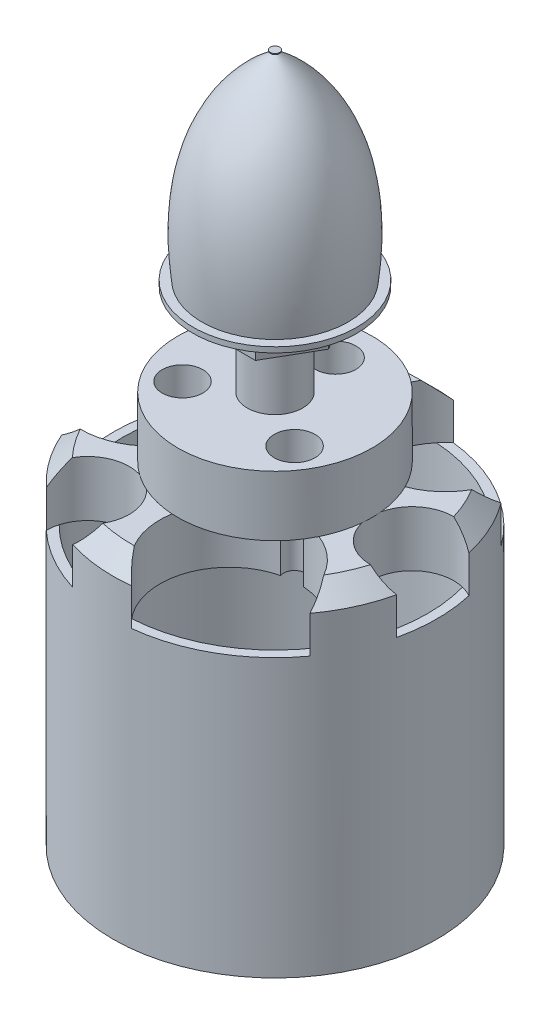
from build123d import *

# Parameters (mm, degrees)
IZIM1_R                     = 17.5
IZIM1_R_2                   = 16.5
Y_KSEKLIK_EKSTR_ZYON1_DEPTH = 30
IZIM4_R                     = 1
KES_EKSTR_ZYON1_DEPTH       = 30
IZIM5_R                     = 4.5
KES_EKSTR_ZYON2_DEPTH       = 8
IZIM6_R                     = 7.5
KES_EKSTR_ZYON3_DEPTH       = 8
IZIM8_R                     = 10.5
Y_KSEKLIK_EKSTR_ZYON3_DEPTH = 6.5
IZIM9_R                     = 3
Y_KSEKLIK_EKSTR_ZYON4_DEPTH = 23.5
IZIM13_R                    = 1.2
KES_EKSTR_ZYON4_DEPTH       = 23.5
IZIM14_R                    = 2.2
KES_EKSTR_ZYON5_DEPTH       = 3.5
Y_KSEKLIK_EKSTR_ZYON5_START = 6.9
Y_KSEKLIK_EKSTR_ZYON5_DEPTH = 5
Y_KSEKLIK_EKSTR_ZYON6_START = 31.95
IZIM18_R                    = 0.5
Y_KSEKLIK_EKSTR_ZYON6_DEPTH = 0.1


with BuildPart() as part:
    # Çizim1 → Yükseklik-Ekstrüzyon1 (new body)
    with BuildSketch(Plane(origin=(0, 0, 0), x_dir=(1, 0, 0), z_dir=(0, 1, 0))):
        Circle(IZIM1_R)
        Circle(IZIM1_R_2, mode=Mode.SUBTRACT)
    extrude(amount=-Y_KSEKLIK_EKSTR_ZYON1_DEPTH)

    # Çizim3 → Döndür1 (revolve)
    with BuildSketch(Plane.XY):
        Polygon((0, 0), (17.5, 0), (17.5, 4), (15.5, 6), (5.4, 6), (5.4, 8), (0, 8), align=None)
    revolve(axis=Axis((0, 8, 0), (0, -1, 0)))

    # Çizim4 → Kes-Ekstrüzyon1 (cut)
    with BuildSketch(Plane(origin=(0, 8, 0), x_dir=(1, 0, 0), z_dir=(0, 1, 0))):
        with Locations((7, 0)):
            Circle(IZIM4_R)
        with Locations((-3.5, -6.062177826)):
            Circle(IZIM4_R)
        with Locations((-3.5, 6.062177826)):
            Circle(IZIM4_R)
    extrude(amount=-KES_EKSTR_ZYON1_DEPTH, mode=Mode.SUBTRACT)

    # Çizim5 → Kes-Ekstrüzyon2 (cut)
    with BuildSketch(Plane(origin=(0, 8, 0), x_dir=(1, 0, 0), z_dir=(0, 1, 0))):
        with Locations((14.83, 0)):
            Circle(IZIM5_R)
        with Locations((-7.415, -12.843156738)):
            Circle(IZIM5_R)
        with Locations((-7.415, 12.843156738)):
            Circle(IZIM5_R)
    extrude(amount=-KES_EKSTR_ZYON2_DEPTH, mode=Mode.SUBTRACT)

    # Çizim6 → Kes-Ekstrüzyon3 (cut)
    with BuildSketch(Plane(origin=(0, 8, 0), x_dir=(1, 0, 0), z_dir=(0, 1, 0))):
        with Locations((6.74, 11.674022443)):
            Circle(IZIM6_R)
        with Locations((6.74, -11.674022443)):
            Circle(IZIM6_R)
        with Locations((-13.48, 0)):
            Circle(IZIM6_R)
    extrude(amount=-KES_EKSTR_ZYON3_DEPTH, mode=Mode.SUBTRACT)

    # Çizim8 → Yükseklik-Ekstrüzyon3 (add)
    with BuildSketch(Plane(origin=(0, 6, 0), x_dir=(1, 0, 0), z_dir=(0, 1, 0))):
        Circle(IZIM8_R)
    extrude(amount=Y_KSEKLIK_EKSTR_ZYON3_DEPTH)

    # Çizim9 → Yükseklik-Ekstrüzyon4 (add)
    with BuildSketch(Plane(origin=(0, 12.5, 0), x_dir=(1, 0, 0), z_dir=(0, 1, 0))):
        Circle(IZIM9_R)
    extrude(amount=Y_KSEKLIK_EKSTR_ZYON4_DEPTH)

    # Çizim13 → Kes-Ekstrüzyon4 (cut)
    with BuildSketch(Plane(origin=(0, 12.5, 0), x_dir=(1, 0, 0), z_dir=(0, 1, 0))):
        with Locations((0.06, 6.496227894)):
            Circle(IZIM13_R)
        with Locations((6.12, -4)):
            Circle(IZIM13_R)
        with Locations((-6, -4)):
            Circle(IZIM13_R)
    extrude(amount=-KES_EKSTR_ZYON4_DEPTH, mode=Mode.SUBTRACT)

    # Çizim14 → Kes-Ekstrüzyon5 (cut)
    with BuildSketch(Plane(origin=(0, 12.5, 0), x_dir=(1, 0, 0), z_dir=(0, 1, 0))):
        with Locations((0.06, 6.496227894)):
            Circle(IZIM14_R)
        with Locations((6.12, -4)):
            Circle(IZIM14_R)
        with Locations((-6, -4)):
            Circle(IZIM14_R)
    extrude(amount=-KES_EKSTR_ZYON5_DEPTH, mode=Mode.SUBTRACT)

    # Çizim15 → Yükseklik-Ekstrüzyon5 (add)
    with BuildSketch(Plane(origin=(0, 12.5, 0), x_dir=(1, 0, 0), z_dir=(0, 1, 0)).offset(Y_KSEKLIK_EKSTR_ZYON5_START)):
        Polygon((2.886751346, 5), (-2.886751346, 5), (-5.773502692, 0), (-2.886751346, -5), (2.886751346, -5), (5.773502692, 0), align=None)
    extrude(amount=Y_KSEKLIK_EKSTR_ZYON5_DEPTH)

    # Çizim17 → Döndür2 (revolve)
    with BuildSketch(Plane.XY):
        with BuildLine():
            Line((0, 21.9), (0, 44.45))
            add(Edge.make_bspline(
                [(7.902249986, 23), (9.696199014, 38.036586862), (0, 44.45)],
                knots=[0, 0, 0, 1, 1, 1], degree=2))
            Line((7.902249986, 23), (8.862249986, 23))
            Line((8.862249986, 23), (8.862249986, 22.42))
            Line((8.862249986, 22.42), (6.55, 21.9))
            Line((6.55, 21.9), (0, 21.9))
        make_face()
    revolve(axis=Axis((0, 21.9, 0), (0, 1, 0)))


with BuildPart() as body_2:
    # Çizim18 → Yükseklik-Ekstrüzyon6 (new body)
    with BuildSketch(Plane(origin=(0, 12.5, 0), x_dir=(1, 0, 0), z_dir=(0, 1, 0)).offset(Y_KSEKLIK_EKSTR_ZYON6_START)):
        Circle(IZIM18_R)
    extrude(amount=Y_KSEKLIK_EKSTR_ZYON6_DEPTH)


solid = Compound([part.part, body_2.part])
